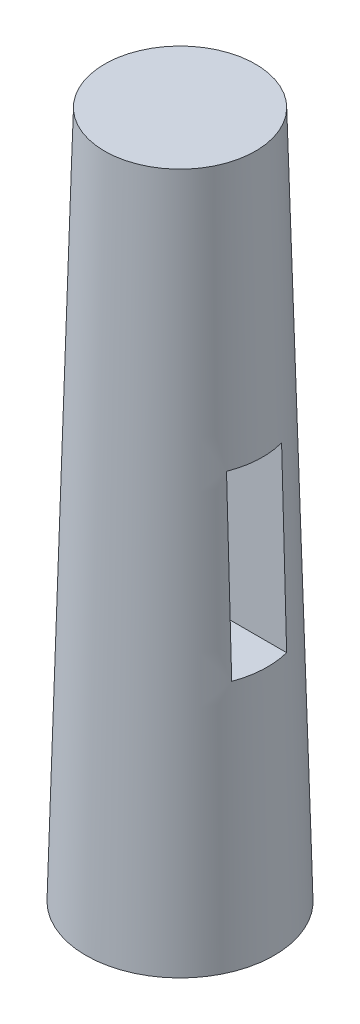
from build123d import *

# Parameters (mm, degrees)
CUT_EXTRUDE1_DEPTH      = 67.746531734
CUT_EXTRUDE1_DEPTH_BACK = 67.746531734
SKETCH3_W               = 7
SKETCH3_H               = 24


with BuildPart() as part:
    # Sketch2 → Revolve1 (revolve)
    with BuildSketch(Plane.XY, mode=Mode.PRIVATE) as revolve1_sk:
        Polygon((0, 64.324019608), (10.1, 64.324019608), (12.6, -27.675980392), (0, -27.675980392), align=None)
    revolve(revolve1_sk.sketch.rotate(Axis((0, 86.777607614, 0), (0, -1, 0)), 90), axis=Axis((0, 86.777607614, 0), (0, -1, 0)))

    # Sketch3 → Cut-Extrude1 (cut, two sides: drawn at the far end of the back side and taken through both)
    with BuildSketch(Plane(origin=(0, 0, 0), x_dir=(0, 0, -1), z_dir=(1, 0, 0)).offset(-CUT_EXTRUDE1_DEPTH_BACK)):
        with Locations((-0.559695247, 17.324019608)):
            Rectangle(SKETCH3_W, SKETCH3_H)
    extrude(amount=CUT_EXTRUDE1_DEPTH + CUT_EXTRUDE1_DEPTH_BACK, mode=Mode.SUBTRACT)


solid = part.part
